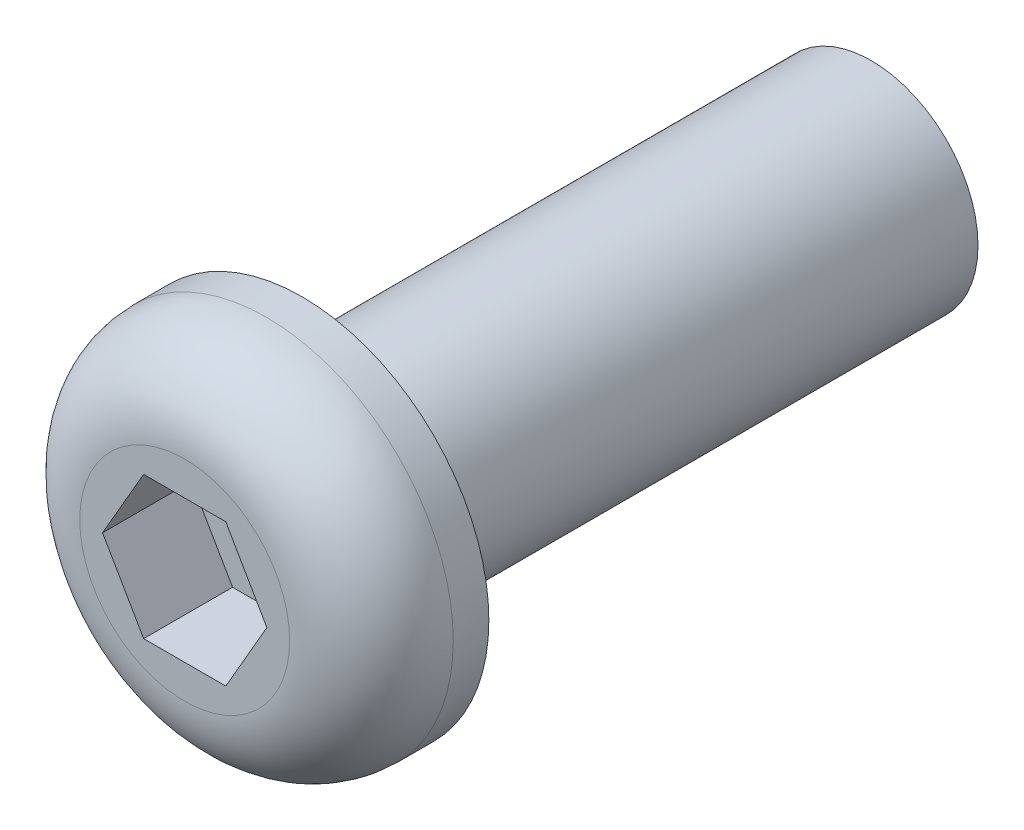
from build123d import *

# Parameters (mm, degrees)
SKETCH1_R          = 3
EXTRUDE1_DEPTH     = 16
CUT_EXTRUDE1_DEPTH = 2.5


with BuildPart() as part:
    # Sketch1 → Extrude1 (new body)
    with BuildSketch(Plane.XY):
        Circle(SKETCH1_R)
    extrude(amount=-EXTRUDE1_DEPTH)

    # Sketch2 → Revolve1 (revolve)
    with BuildSketch(Plane(origin=(0, 0, 0), x_dir=(0, 0, -1), z_dir=(1, 0, 0)), mode=Mode.PRIVATE) as revolve1_sk:
        with BuildLine():
            Line((0, 0), (0, 5.25))
            Line((0, 5.25), (-1, 5.25))
            ThreePointArc((-1, 5.25), (-2.626345597, 4.576345597), (-3.3, 2.95))
            Line((-3.3, 2.95), (-3.3, 0))
            Line((-3.3, 0), (0, 0))
        make_face()
    revolve(revolve1_sk.sketch.rotate(Axis((0, 0, 0), (0, 0, 1)), 90), axis=Axis((0, 0, 0), (0, 0, 1)))

    # Sketch3 → Cut-Extrude1 (cut)
    with BuildSketch(Plane.XY.offset(3.3)):
        Polygon((-1.154700538, 2), (-2.309401077, 0), (-1.154700538, -2), (1.154700538, -2), (2.309401077, 0), (1.154700538, 2), align=None)
    extrude(amount=-CUT_EXTRUDE1_DEPTH, mode=Mode.SUBTRACT)


solid = part.part
